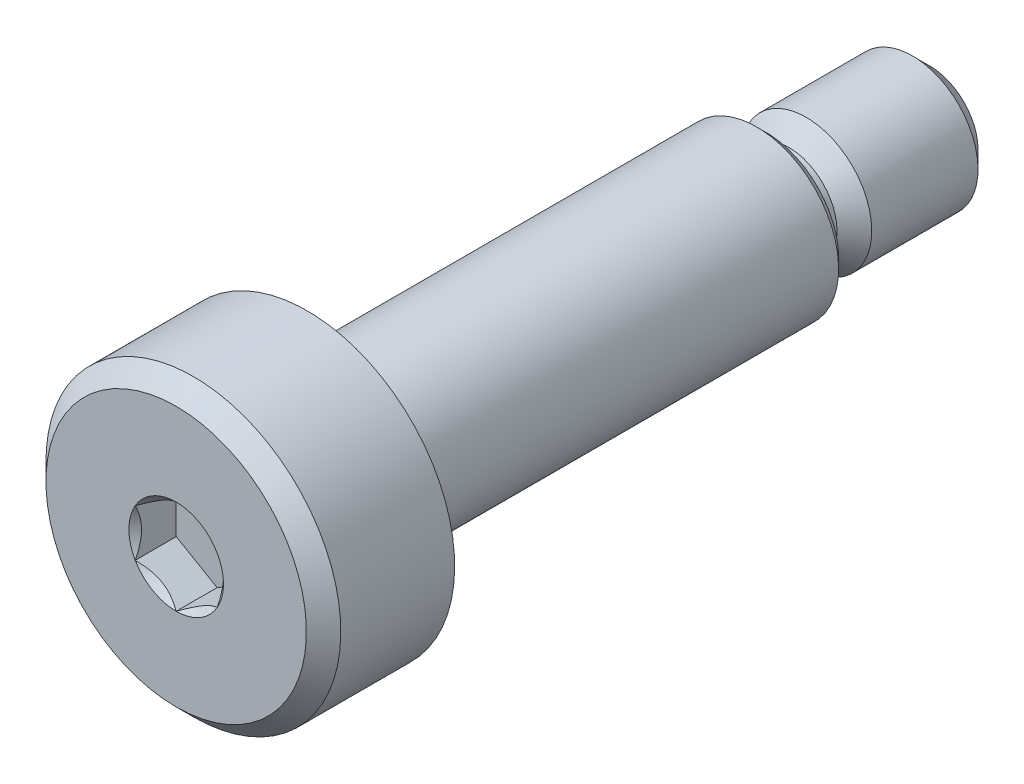
from build123d import *

# Parameters (mm, degrees)
CUT_EXTRUDE1_DEPTH = 1.25
SKETCH4_R          = 1.443375673
CUT_EXTRUDE2_DEPTH = 1.25
CUT_EXTRUDE2_DRAFT = -45


with BuildPart() as part:
    # Sketch2 → Revolve1 (revolve)
    with BuildSketch(Plane(origin=(0, 0, 0), x_dir=(0, 0, -1), z_dir=(1, 0, 0))):
        with BuildLine():
            Line((11.5, 0), (11.5, 1.475))
            Line((11.5, 1.475), (10.975, 2))
            Line((10.975, 2), (7.73044056, 2))
            Line((7.73044056, 2), (7.2, 1.46955944))
            Line((7.2, 1.46955944), (6.85, 1.46955944))
            ThreePointArc((6.85, 1.46955944), (6.602512627, 1.572072067), (6.5, 1.81955944))
            Line((6.5, 1.81955944), (6.5, 2.22))
            Line((6.5, 2.22), (6.22, 2.5))
            Line((6.22, 2.5), (-6.665284937, 2.5))
            Line((-6.665284937, 2.5), (-6.8, 2.266666667))
            Line((-6.8, 2.266666667), (-7.266666667, 2.266666667))
            ThreePointArc((-7.266666667, 2.266666667), (-7.431658249, 2.335008418), (-7.5, 2.5))
            Line((-7.5, 2.5), (-7.5, 4.5))
            Line((-7.5, 4.5), (-10.975, 4.5))
            Line((-10.975, 4.5), (-11.5, 3.975))
            Line((-11.5, 3.975), (-11.5, 0))
            Line((-11.5, 0), (11.5, 0))
        make_face()
    revolve(axis=Axis((0, 0, 11.5), (0, 0, -1)))

    # Sketch3 → Cut-Extrude1 (cut)
    with BuildSketch(Plane.XY.offset(11.5)):
        Polygon((0, 1.443375673), (-1.25, 0.721687836), (-1.25, -0.721687836), (0, -1.443375673), (1.25, -0.721687836), (1.25, 0.721687836), align=None)
    extrude(amount=-CUT_EXTRUDE1_DEPTH, mode=Mode.SUBTRACT)


with BuildPart() as cut_extrude2_tool:
    # Sketch4 → Cut-Extrude2 (with draft: the straight prism first)
    with BuildSketch(Plane.XY.offset(11.5)):
        Circle(SKETCH4_R)
    extrude(amount=-CUT_EXTRUDE2_DEPTH)
    # Cut-Extrude2: the draft: its side faces are tilted about the plane it starts from
    cut_extrude2_sides = [cut_extrude2_tool.faces().sort_by_distance(p)[0] for p in [
        (-1.443375673, 0, 10.875),
    ]]
    draft(cut_extrude2_sides, Plane.XY.offset(11.5), CUT_EXTRUDE2_DRAFT)


with BuildPart() as part_1:
    add(part.part)

    # Cut-Extrude2: cut by cut_extrude2_tool
    add(cut_extrude2_tool.part, mode=Mode.SUBTRACT)


solid = part_1.part
